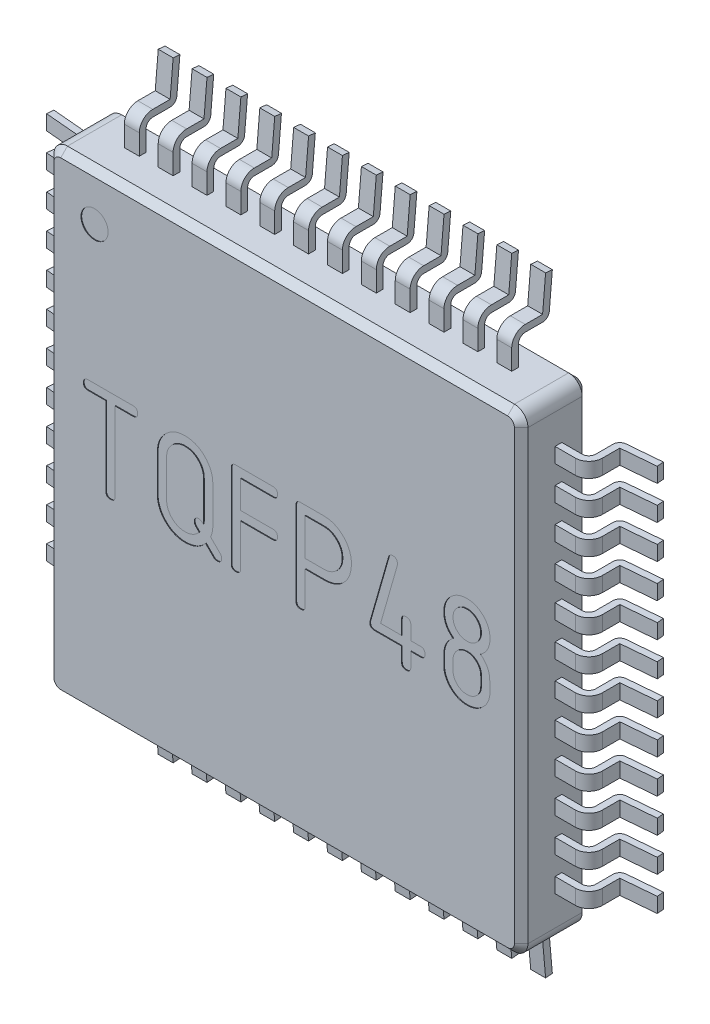
from build123d import *

# Parameters (mm, degrees)
EXTRUDE_1_DEPTH                  = 1
CHAMFER_1_SIZE                   = 0.1
EXTRUDE_2_DEPTH                  = 0.11
PATTERN_LINEAR_1_COUNT           = 12
PATTERN_LINEAR_1_PITCH           = 0.5
PATTERN_CIRCULAR_1_COUNT         = 4
PATTERN_CIRCULAR_1_COPY_1_DEPTH  = 0.11
PATTERN_CIRCULAR_1_COPY_2_DEPTH  = 0.11
PATTERN_CIRCULAR_1_COPY_3_DEPTH  = 0.11
PATTERN_CIRCULAR_1_COPY_4_DEPTH  = 0.11
PATTERN_CIRCULAR_1_COPY_5_DEPTH  = 0.11
PATTERN_CIRCULAR_1_COPY_6_DEPTH  = 0.11
PATTERN_CIRCULAR_1_COPY_7_DEPTH  = 0.11
PATTERN_CIRCULAR_1_COPY_8_DEPTH  = 0.11
PATTERN_CIRCULAR_1_COPY_9_DEPTH  = 0.11
PATTERN_CIRCULAR_1_COPY_10_DEPTH = 0.11
PATTERN_CIRCULAR_1_COPY_11_DEPTH = 0.11
PATTERN_CIRCULAR_1_COPY_12_DEPTH = 0.11
PATTERN_CIRCULAR_1_COPY_13_DEPTH = 0.11
PATTERN_CIRCULAR_1_COPY_14_DEPTH = 0.11
PATTERN_CIRCULAR_1_COPY_15_DEPTH = 0.11
PATTERN_CIRCULAR_1_COPY_16_DEPTH = 0.11
PATTERN_CIRCULAR_1_COPY_17_DEPTH = 0.11
PATTERN_CIRCULAR_1_COPY_18_DEPTH = 0.11
PATTERN_CIRCULAR_1_COPY_19_DEPTH = 0.11
PATTERN_CIRCULAR_1_COPY_20_DEPTH = 0.11
PATTERN_CIRCULAR_1_COPY_21_DEPTH = 0.11
PATTERN_CIRCULAR_1_COPY_22_DEPTH = 0.11
PATTERN_CIRCULAR_1_COPY_23_DEPTH = 0.11
PATTERN_CIRCULAR_1_COPY_24_DEPTH = 0.11
PATTERN_CIRCULAR_1_COPY_25_DEPTH = 0.11
PATTERN_CIRCULAR_1_COPY_26_DEPTH = 0.11
PATTERN_CIRCULAR_1_COPY_27_DEPTH = 0.11
PATTERN_CIRCULAR_1_COPY_28_DEPTH = 0.11
PATTERN_CIRCULAR_1_COPY_29_DEPTH = 0.11
PATTERN_CIRCULAR_1_COPY_30_DEPTH = 0.11
PATTERN_CIRCULAR_1_COPY_31_DEPTH = 0.11
PATTERN_CIRCULAR_1_COPY_32_DEPTH = 0.11
PATTERN_CIRCULAR_1_COPY_33_DEPTH = 0.11
SKETCH_4_R                       = 0.2
CUT_EXTRUDE_1_DEPTH              = 0.01


with BuildPart() as part:
    # Эскиз2 → Бобышка-Вытянуть1 (new body)
    with BuildSketch(Plane.XY.offset(0.1)):
        with BuildLine():
            Line((-3.3, 3.5), (3.3, 3.5))
            ThreePointArc((3.3, 3.5), (3.441421356, 3.441421356), (3.5, 3.3))
            Line((3.5, 3.3), (3.5, -3.3))
            ThreePointArc((3.5, -3.3), (3.441421356, -3.441421356), (3.3, -3.5))
            Line((3.3, -3.5), (-3.3, -3.5))
            ThreePointArc((-3.3, -3.5), (-3.441421356, -3.441421356), (-3.5, -3.3))
            Line((-3.5, -3.3), (-3.5, 3.3))
            ThreePointArc((-3.5, 3.3), (-3.441421356, 3.441421356), (-3.3, 3.5))
        make_face()
    extrude(amount=EXTRUDE_1_DEPTH)

    # Фаска1
    chamfer_1_edges = [part.edges().sort_by_distance(p)[0] for p in [
        (3.441421356, -3.441421356, 1.1),
        (0, -3.5, 0.1),
        (-3.441421356, -3.441421356, 0.1),
        (3.5, 0, 1.1),
        (3.441421356, 3.441421356, 1.1),
        (0, 3.5, 1.1),
        (-3.441421356, 3.441421356, 1.1),
        (-3.5, 0, 1.1),
        (-3.441421356, -3.441421356, 1.1),
        (0, -3.5, 1.1),
        (-3.5, 0, 0.1),
        (-3.441421356, 3.441421356, 0.1),
        (0, 3.5, 0.1),
        (3.441421356, 3.441421356, 0.1),
        (3.5, 0, 0.1),
        (3.441421356, -3.441421356, 0.1),
    ]]
    chamfer(chamfer_1_edges, length=CHAMFER_1_SIZE)

    # Эскиз3 → Бобышка-Вытянуть2 (add, symmetric)
    with BuildSketch(Plane(origin=(0, 2.75, 0), x_dir=(-1, 0, 0), z_dir=(0, 1, 0))):
        with BuildLine():
            Line((3.5, 0.5), (3.8, 0.5))
            ThreePointArc((3.8, 0.5), (3.870710678, 0.470710678), (3.9, 0.4))
            Line((3.9, 0.4), (3.9, 0.144126316))
            ThreePointArc((3.9, 0.144126316), (3.926272266, 0.076567295), (3.991284426, 0.044506846))
            Line((3.991284426, 0.044506846), (4.5, 0))
            Line((4.5, 0), (4.508715574, 0.09961947))
            Line((4.508715574, 0.09961947), (4, 0.144126316))
            Line((4, 0.144126316), (4, 0.4))
            ThreePointArc((4, 0.4), (3.941421356, 0.541421356), (3.8, 0.6))
            Line((3.8, 0.6), (3.5, 0.6))
            Line((3.5, 0.6), (3.5, 0.5))
        make_face()
    extrude_2 = extrude(amount=EXTRUDE_2_DEPTH, both=True)

    # Линейный массив1: Бобышка-Вытянуть2 ×12
    with Locations(*[(0, -i * PATTERN_LINEAR_1_PITCH, 0) for i in range(1, PATTERN_LINEAR_1_COUNT)]):
        add(extrude_2)

    # Круговой массив1: Бобышка-Вытянуть2 ×4 about axis
    pattern_circular_1_axis = Axis((0, 0, 0), (0, 0, 1))
    for i in range(1, PATTERN_CIRCULAR_1_COUNT):
        add(extrude_2.rotate(pattern_circular_1_axis, i * 360 / PATTERN_CIRCULAR_1_COUNT))

    # Круговой массив1 copy 1 sketch → Круговой массив1 copy 1 (add, symmetric)
    with BuildSketch(Plane(origin=(-2.25, 0, 0), x_dir=(0, -1, 0), z_dir=(-1, 0, 0))):
        with BuildLine():
            Line((3.5, 0.5), (3.8, 0.5))
            ThreePointArc((3.8, 0.5), (3.870710678, 0.470710678), (3.9, 0.4))
            Line((3.9, 0.4), (3.9, 0.144126316))
            ThreePointArc((3.9, 0.144126316), (3.926272266, 0.076567295), (3.991284426, 0.044506846))
            Line((3.991284426, 0.044506846), (4.5, 0))
            Line((4.5, 0), (4.508715574, 0.09961947))
            Line((4.508715574, 0.09961947), (4, 0.144126316))
            Line((4, 0.144126316), (4, 0.4))
            ThreePointArc((4, 0.4), (3.941421356, 0.541421356), (3.8, 0.6))
            Line((3.8, 0.6), (3.5, 0.6))
            Line((3.5, 0.6), (3.5, 0.5))
        make_face()
    extrude(amount=PATTERN_CIRCULAR_1_COPY_1_DEPTH, both=True)

    # Круговой массив1 copy 2 sketch → Круговой массив1 copy 2 (add, symmetric)
    with BuildSketch(Plane.XZ.offset(2.25)):
        with BuildLine():
            Line((3.5, 0.5), (3.8, 0.5))
            ThreePointArc((3.8, 0.5), (3.870710678, 0.470710678), (3.9, 0.4))
            Line((3.9, 0.4), (3.9, 0.144126316))
            ThreePointArc((3.9, 0.144126316), (3.926272266, 0.076567295), (3.991284426, 0.044506846))
            Line((3.991284426, 0.044506846), (4.5, 0))
            Line((4.5, 0), (4.508715574, 0.09961947))
            Line((4.508715574, 0.09961947), (4, 0.144126316))
            Line((4, 0.144126316), (4, 0.4))
            ThreePointArc((4, 0.4), (3.941421356, 0.541421356), (3.8, 0.6))
            Line((3.8, 0.6), (3.5, 0.6))
            Line((3.5, 0.6), (3.5, 0.5))
        make_face()
    extrude(amount=PATTERN_CIRCULAR_1_COPY_2_DEPTH, both=True)

    # Круговой массив1 copy 3 sketch → Круговой массив1 copy 3 (add, symmetric)
    with BuildSketch(Plane.YZ.offset(2.25)):
        with BuildLine():
            Line((3.5, 0.5), (3.8, 0.5))
            ThreePointArc((3.8, 0.5), (3.870710678, 0.470710678), (3.9, 0.4))
            Line((3.9, 0.4), (3.9, 0.144126316))
            ThreePointArc((3.9, 0.144126316), (3.926272266, 0.076567295), (3.991284426, 0.044506846))
            Line((3.991284426, 0.044506846), (4.5, 0))
            Line((4.5, 0), (4.508715574, 0.09961947))
            Line((4.508715574, 0.09961947), (4, 0.144126316))
            Line((4, 0.144126316), (4, 0.4))
            ThreePointArc((4, 0.4), (3.941421356, 0.541421356), (3.8, 0.6))
            Line((3.8, 0.6), (3.5, 0.6))
            Line((3.5, 0.6), (3.5, 0.5))
        make_face()
    extrude(amount=PATTERN_CIRCULAR_1_COPY_3_DEPTH, both=True)

    # Круговой массив1 copy 4 sketch → Круговой массив1 copy 4 (add, symmetric)
    with BuildSketch(Plane(origin=(-1.75, 0, 0), x_dir=(0, -1, 0), z_dir=(-1, 0, 0))):
        with BuildLine():
            Line((3.5, 0.5), (3.8, 0.5))
            ThreePointArc((3.8, 0.5), (3.870710678, 0.470710678), (3.9, 0.4))
            Line((3.9, 0.4), (3.9, 0.144126316))
            ThreePointArc((3.9, 0.144126316), (3.926272266, 0.076567295), (3.991284426, 0.044506846))
            Line((3.991284426, 0.044506846), (4.5, 0))
            Line((4.5, 0), (4.508715574, 0.09961947))
            Line((4.508715574, 0.09961947), (4, 0.144126316))
            Line((4, 0.144126316), (4, 0.4))
            ThreePointArc((4, 0.4), (3.941421356, 0.541421356), (3.8, 0.6))
            Line((3.8, 0.6), (3.5, 0.6))
            Line((3.5, 0.6), (3.5, 0.5))
        make_face()
    extrude(amount=PATTERN_CIRCULAR_1_COPY_4_DEPTH, both=True)

    # Круговой массив1 copy 5 sketch → Круговой массив1 copy 5 (add, symmetric)
    with BuildSketch(Plane.XZ.offset(1.75)):
        with BuildLine():
            Line((3.5, 0.5), (3.8, 0.5))
            ThreePointArc((3.8, 0.5), (3.870710678, 0.470710678), (3.9, 0.4))
            Line((3.9, 0.4), (3.9, 0.144126316))
            ThreePointArc((3.9, 0.144126316), (3.926272266, 0.076567295), (3.991284426, 0.044506846))
            Line((3.991284426, 0.044506846), (4.5, 0))
            Line((4.5, 0), (4.508715574, 0.09961947))
            Line((4.508715574, 0.09961947), (4, 0.144126316))
            Line((4, 0.144126316), (4, 0.4))
            ThreePointArc((4, 0.4), (3.941421356, 0.541421356), (3.8, 0.6))
            Line((3.8, 0.6), (3.5, 0.6))
            Line((3.5, 0.6), (3.5, 0.5))
        make_face()
    extrude(amount=PATTERN_CIRCULAR_1_COPY_5_DEPTH, both=True)

    # Круговой массив1 copy 6 sketch → Круговой массив1 copy 6 (add, symmetric)
    with BuildSketch(Plane.YZ.offset(1.75)):
        with BuildLine():
            Line((3.5, 0.5), (3.8, 0.5))
            ThreePointArc((3.8, 0.5), (3.870710678, 0.470710678), (3.9, 0.4))
            Line((3.9, 0.4), (3.9, 0.144126316))
            ThreePointArc((3.9, 0.144126316), (3.926272266, 0.076567295), (3.991284426, 0.044506846))
            Line((3.991284426, 0.044506846), (4.5, 0))
            Line((4.5, 0), (4.508715574, 0.09961947))
            Line((4.508715574, 0.09961947), (4, 0.144126316))
            Line((4, 0.144126316), (4, 0.4))
            ThreePointArc((4, 0.4), (3.941421356, 0.541421356), (3.8, 0.6))
            Line((3.8, 0.6), (3.5, 0.6))
            Line((3.5, 0.6), (3.5, 0.5))
        make_face()
    extrude(amount=PATTERN_CIRCULAR_1_COPY_6_DEPTH, both=True)

    # Круговой массив1 copy 7 sketch → Круговой массив1 copy 7 (add, symmetric)
    with BuildSketch(Plane(origin=(-1.25, 0, 0), x_dir=(0, -1, 0), z_dir=(-1, 0, 0))):
        with BuildLine():
            Line((3.5, 0.5), (3.8, 0.5))
            ThreePointArc((3.8, 0.5), (3.870710678, 0.470710678), (3.9, 0.4))
            Line((3.9, 0.4), (3.9, 0.144126316))
            ThreePointArc((3.9, 0.144126316), (3.926272266, 0.076567295), (3.991284426, 0.044506846))
            Line((3.991284426, 0.044506846), (4.5, 0))
            Line((4.5, 0), (4.508715574, 0.09961947))
            Line((4.508715574, 0.09961947), (4, 0.144126316))
            Line((4, 0.144126316), (4, 0.4))
            ThreePointArc((4, 0.4), (3.941421356, 0.541421356), (3.8, 0.6))
            Line((3.8, 0.6), (3.5, 0.6))
            Line((3.5, 0.6), (3.5, 0.5))
        make_face()
    extrude(amount=PATTERN_CIRCULAR_1_COPY_7_DEPTH, both=True)

    # Круговой массив1 copy 8 sketch → Круговой массив1 copy 8 (add, symmetric)
    with BuildSketch(Plane.XZ.offset(1.25)):
        with BuildLine():
            Line((3.5, 0.5), (3.8, 0.5))
            ThreePointArc((3.8, 0.5), (3.870710678, 0.470710678), (3.9, 0.4))
            Line((3.9, 0.4), (3.9, 0.144126316))
            ThreePointArc((3.9, 0.144126316), (3.926272266, 0.076567295), (3.991284426, 0.044506846))
            Line((3.991284426, 0.044506846), (4.5, 0))
            Line((4.5, 0), (4.508715574, 0.09961947))
            Line((4.508715574, 0.09961947), (4, 0.144126316))
            Line((4, 0.144126316), (4, 0.4))
            ThreePointArc((4, 0.4), (3.941421356, 0.541421356), (3.8, 0.6))
            Line((3.8, 0.6), (3.5, 0.6))
            Line((3.5, 0.6), (3.5, 0.5))
        make_face()
    extrude(amount=PATTERN_CIRCULAR_1_COPY_8_DEPTH, both=True)

    # Круговой массив1 copy 9 sketch → Круговой массив1 copy 9 (add, symmetric)
    with BuildSketch(Plane.YZ.offset(1.25)):
        with BuildLine():
            Line((3.5, 0.5), (3.8, 0.5))
            ThreePointArc((3.8, 0.5), (3.870710678, 0.470710678), (3.9, 0.4))
            Line((3.9, 0.4), (3.9, 0.144126316))
            ThreePointArc((3.9, 0.144126316), (3.926272266, 0.076567295), (3.991284426, 0.044506846))
            Line((3.991284426, 0.044506846), (4.5, 0))
            Line((4.5, 0), (4.508715574, 0.09961947))
            Line((4.508715574, 0.09961947), (4, 0.144126316))
            Line((4, 0.144126316), (4, 0.4))
            ThreePointArc((4, 0.4), (3.941421356, 0.541421356), (3.8, 0.6))
            Line((3.8, 0.6), (3.5, 0.6))
            Line((3.5, 0.6), (3.5, 0.5))
        make_face()
    extrude(amount=PATTERN_CIRCULAR_1_COPY_9_DEPTH, both=True)

    # Круговой массив1 copy 10 sketch → Круговой массив1 copy 10 (add, symmetric)
    with BuildSketch(Plane(origin=(-0.75, 0, 0), x_dir=(0, -1, 0), z_dir=(-1, 0, 0))):
        with BuildLine():
            Line((3.5, 0.5), (3.8, 0.5))
            ThreePointArc((3.8, 0.5), (3.870710678, 0.470710678), (3.9, 0.4))
            Line((3.9, 0.4), (3.9, 0.144126316))
            ThreePointArc((3.9, 0.144126316), (3.926272266, 0.076567295), (3.991284426, 0.044506846))
            Line((3.991284426, 0.044506846), (4.5, 0))
            Line((4.5, 0), (4.508715574, 0.09961947))
            Line((4.508715574, 0.09961947), (4, 0.144126316))
            Line((4, 0.144126316), (4, 0.4))
            ThreePointArc((4, 0.4), (3.941421356, 0.541421356), (3.8, 0.6))
            Line((3.8, 0.6), (3.5, 0.6))
            Line((3.5, 0.6), (3.5, 0.5))
        make_face()
    extrude(amount=PATTERN_CIRCULAR_1_COPY_10_DEPTH, both=True)

    # Круговой массив1 copy 11 sketch → Круговой массив1 copy 11 (add, symmetric)
    with BuildSketch(Plane.XZ.offset(0.75)):
        with BuildLine():
            Line((3.5, 0.5), (3.8, 0.5))
            ThreePointArc((3.8, 0.5), (3.870710678, 0.470710678), (3.9, 0.4))
            Line((3.9, 0.4), (3.9, 0.144126316))
            ThreePointArc((3.9, 0.144126316), (3.926272266, 0.076567295), (3.991284426, 0.044506846))
            Line((3.991284426, 0.044506846), (4.5, 0))
            Line((4.5, 0), (4.508715574, 0.09961947))
            Line((4.508715574, 0.09961947), (4, 0.144126316))
            Line((4, 0.144126316), (4, 0.4))
            ThreePointArc((4, 0.4), (3.941421356, 0.541421356), (3.8, 0.6))
            Line((3.8, 0.6), (3.5, 0.6))
            Line((3.5, 0.6), (3.5, 0.5))
        make_face()
    extrude(amount=PATTERN_CIRCULAR_1_COPY_11_DEPTH, both=True)

    # Круговой массив1 copy 12 sketch → Круговой массив1 copy 12 (add, symmetric)
    with BuildSketch(Plane.YZ.offset(0.75)):
        with BuildLine():
            Line((3.5, 0.5), (3.8, 0.5))
            ThreePointArc((3.8, 0.5), (3.870710678, 0.470710678), (3.9, 0.4))
            Line((3.9, 0.4), (3.9, 0.144126316))
            ThreePointArc((3.9, 0.144126316), (3.926272266, 0.076567295), (3.991284426, 0.044506846))
            Line((3.991284426, 0.044506846), (4.5, 0))
            Line((4.5, 0), (4.508715574, 0.09961947))
            Line((4.508715574, 0.09961947), (4, 0.144126316))
            Line((4, 0.144126316), (4, 0.4))
            ThreePointArc((4, 0.4), (3.941421356, 0.541421356), (3.8, 0.6))
            Line((3.8, 0.6), (3.5, 0.6))
            Line((3.5, 0.6), (3.5, 0.5))
        make_face()
    extrude(amount=PATTERN_CIRCULAR_1_COPY_12_DEPTH, both=True)

    # Круговой массив1 copy 13 sketch → Круговой массив1 copy 13 (add, symmetric)
    with BuildSketch(Plane(origin=(-0.25, 0, 0), x_dir=(0, -1, 0), z_dir=(-1, 0, 0))):
        with BuildLine():
            Line((3.5, 0.5), (3.8, 0.5))
            ThreePointArc((3.8, 0.5), (3.870710678, 0.470710678), (3.9, 0.4))
            Line((3.9, 0.4), (3.9, 0.144126316))
            ThreePointArc((3.9, 0.144126316), (3.926272266, 0.076567295), (3.991284426, 0.044506846))
            Line((3.991284426, 0.044506846), (4.5, 0))
            Line((4.5, 0), (4.508715574, 0.09961947))
            Line((4.508715574, 0.09961947), (4, 0.144126316))
            Line((4, 0.144126316), (4, 0.4))
            ThreePointArc((4, 0.4), (3.941421356, 0.541421356), (3.8, 0.6))
            Line((3.8, 0.6), (3.5, 0.6))
            Line((3.5, 0.6), (3.5, 0.5))
        make_face()
    extrude(amount=PATTERN_CIRCULAR_1_COPY_13_DEPTH, both=True)

    # Круговой массив1 copy 14 sketch → Круговой массив1 copy 14 (add, symmetric)
    with BuildSketch(Plane.XZ.offset(0.25)):
        with BuildLine():
            Line((3.5, 0.5), (3.8, 0.5))
            ThreePointArc((3.8, 0.5), (3.870710678, 0.470710678), (3.9, 0.4))
            Line((3.9, 0.4), (3.9, 0.144126316))
            ThreePointArc((3.9, 0.144126316), (3.926272266, 0.076567295), (3.991284426, 0.044506846))
            Line((3.991284426, 0.044506846), (4.5, 0))
            Line((4.5, 0), (4.508715574, 0.09961947))
            Line((4.508715574, 0.09961947), (4, 0.144126316))
            Line((4, 0.144126316), (4, 0.4))
            ThreePointArc((4, 0.4), (3.941421356, 0.541421356), (3.8, 0.6))
            Line((3.8, 0.6), (3.5, 0.6))
            Line((3.5, 0.6), (3.5, 0.5))
        make_face()
    extrude(amount=PATTERN_CIRCULAR_1_COPY_14_DEPTH, both=True)

    # Круговой массив1 copy 15 sketch → Круговой массив1 copy 15 (add, symmetric)
    with BuildSketch(Plane.YZ.offset(0.25)):
        with BuildLine():
            Line((3.5, 0.5), (3.8, 0.5))
            ThreePointArc((3.8, 0.5), (3.870710678, 0.470710678), (3.9, 0.4))
            Line((3.9, 0.4), (3.9, 0.144126316))
            ThreePointArc((3.9, 0.144126316), (3.926272266, 0.076567295), (3.991284426, 0.044506846))
            Line((3.991284426, 0.044506846), (4.5, 0))
            Line((4.5, 0), (4.508715574, 0.09961947))
            Line((4.508715574, 0.09961947), (4, 0.144126316))
            Line((4, 0.144126316), (4, 0.4))
            ThreePointArc((4, 0.4), (3.941421356, 0.541421356), (3.8, 0.6))
            Line((3.8, 0.6), (3.5, 0.6))
            Line((3.5, 0.6), (3.5, 0.5))
        make_face()
    extrude(amount=PATTERN_CIRCULAR_1_COPY_15_DEPTH, both=True)

    # Круговой массив1 copy 16 sketch → Круговой массив1 copy 16 (add, symmetric)
    with BuildSketch(Plane(origin=(0.25, 0, 0), x_dir=(0, -1, 0), z_dir=(-1, 0, 0))):
        with BuildLine():
            Line((3.5, 0.5), (3.8, 0.5))
            ThreePointArc((3.8, 0.5), (3.870710678, 0.470710678), (3.9, 0.4))
            Line((3.9, 0.4), (3.9, 0.144126316))
            ThreePointArc((3.9, 0.144126316), (3.926272266, 0.076567295), (3.991284426, 0.044506846))
            Line((3.991284426, 0.044506846), (4.5, 0))
            Line((4.5, 0), (4.508715574, 0.09961947))
            Line((4.508715574, 0.09961947), (4, 0.144126316))
            Line((4, 0.144126316), (4, 0.4))
            ThreePointArc((4, 0.4), (3.941421356, 0.541421356), (3.8, 0.6))
            Line((3.8, 0.6), (3.5, 0.6))
            Line((3.5, 0.6), (3.5, 0.5))
        make_face()
    extrude(amount=PATTERN_CIRCULAR_1_COPY_16_DEPTH, both=True)

    # Круговой массив1 copy 17 sketch → Круговой массив1 copy 17 (add, symmetric)
    with BuildSketch(Plane.XZ.offset(-0.25)):
        with BuildLine():
            Line((3.5, 0.5), (3.8, 0.5))
            ThreePointArc((3.8, 0.5), (3.870710678, 0.470710678), (3.9, 0.4))
            Line((3.9, 0.4), (3.9, 0.144126316))
            ThreePointArc((3.9, 0.144126316), (3.926272266, 0.076567295), (3.991284426, 0.044506846))
            Line((3.991284426, 0.044506846), (4.5, 0))
            Line((4.5, 0), (4.508715574, 0.09961947))
            Line((4.508715574, 0.09961947), (4, 0.144126316))
            Line((4, 0.144126316), (4, 0.4))
            ThreePointArc((4, 0.4), (3.941421356, 0.541421356), (3.8, 0.6))
            Line((3.8, 0.6), (3.5, 0.6))
            Line((3.5, 0.6), (3.5, 0.5))
        make_face()
    extrude(amount=PATTERN_CIRCULAR_1_COPY_17_DEPTH, both=True)

    # Круговой массив1 copy 18 sketch → Круговой массив1 copy 18 (add, symmetric)
    with BuildSketch(Plane.YZ.offset(-0.25)):
        with BuildLine():
            Line((3.5, 0.5), (3.8, 0.5))
            ThreePointArc((3.8, 0.5), (3.870710678, 0.470710678), (3.9, 0.4))
            Line((3.9, 0.4), (3.9, 0.144126316))
            ThreePointArc((3.9, 0.144126316), (3.926272266, 0.076567295), (3.991284426, 0.044506846))
            Line((3.991284426, 0.044506846), (4.5, 0))
            Line((4.5, 0), (4.508715574, 0.09961947))
            Line((4.508715574, 0.09961947), (4, 0.144126316))
            Line((4, 0.144126316), (4, 0.4))
            ThreePointArc((4, 0.4), (3.941421356, 0.541421356), (3.8, 0.6))
            Line((3.8, 0.6), (3.5, 0.6))
            Line((3.5, 0.6), (3.5, 0.5))
        make_face()
    extrude(amount=PATTERN_CIRCULAR_1_COPY_18_DEPTH, both=True)

    # Круговой массив1 copy 19 sketch → Круговой массив1 copy 19 (add, symmetric)
    with BuildSketch(Plane(origin=(0.75, 0, 0), x_dir=(0, -1, 0), z_dir=(-1, 0, 0))):
        with BuildLine():
            Line((3.5, 0.5), (3.8, 0.5))
            ThreePointArc((3.8, 0.5), (3.870710678, 0.470710678), (3.9, 0.4))
            Line((3.9, 0.4), (3.9, 0.144126316))
            ThreePointArc((3.9, 0.144126316), (3.926272266, 0.076567295), (3.991284426, 0.044506846))
            Line((3.991284426, 0.044506846), (4.5, 0))
            Line((4.5, 0), (4.508715574, 0.09961947))
            Line((4.508715574, 0.09961947), (4, 0.144126316))
            Line((4, 0.144126316), (4, 0.4))
            ThreePointArc((4, 0.4), (3.941421356, 0.541421356), (3.8, 0.6))
            Line((3.8, 0.6), (3.5, 0.6))
            Line((3.5, 0.6), (3.5, 0.5))
        make_face()
    extrude(amount=PATTERN_CIRCULAR_1_COPY_19_DEPTH, both=True)

    # Круговой массив1 copy 20 sketch → Круговой массив1 copy 20 (add, symmetric)
    with BuildSketch(Plane.XZ.offset(-0.75)):
        with BuildLine():
            Line((3.5, 0.5), (3.8, 0.5))
            ThreePointArc((3.8, 0.5), (3.870710678, 0.470710678), (3.9, 0.4))
            Line((3.9, 0.4), (3.9, 0.144126316))
            ThreePointArc((3.9, 0.144126316), (3.926272266, 0.076567295), (3.991284426, 0.044506846))
            Line((3.991284426, 0.044506846), (4.5, 0))
            Line((4.5, 0), (4.508715574, 0.09961947))
            Line((4.508715574, 0.09961947), (4, 0.144126316))
            Line((4, 0.144126316), (4, 0.4))
            ThreePointArc((4, 0.4), (3.941421356, 0.541421356), (3.8, 0.6))
            Line((3.8, 0.6), (3.5, 0.6))
            Line((3.5, 0.6), (3.5, 0.5))
        make_face()
    extrude(amount=PATTERN_CIRCULAR_1_COPY_20_DEPTH, both=True)

    # Круговой массив1 copy 21 sketch → Круговой массив1 copy 21 (add, symmetric)
    with BuildSketch(Plane.YZ.offset(-0.75)):
        with BuildLine():
            Line((3.5, 0.5), (3.8, 0.5))
            ThreePointArc((3.8, 0.5), (3.870710678, 0.470710678), (3.9, 0.4))
            Line((3.9, 0.4), (3.9, 0.144126316))
            ThreePointArc((3.9, 0.144126316), (3.926272266, 0.076567295), (3.991284426, 0.044506846))
            Line((3.991284426, 0.044506846), (4.5, 0))
            Line((4.5, 0), (4.508715574, 0.09961947))
            Line((4.508715574, 0.09961947), (4, 0.144126316))
            Line((4, 0.144126316), (4, 0.4))
            ThreePointArc((4, 0.4), (3.941421356, 0.541421356), (3.8, 0.6))
            Line((3.8, 0.6), (3.5, 0.6))
            Line((3.5, 0.6), (3.5, 0.5))
        make_face()
    extrude(amount=PATTERN_CIRCULAR_1_COPY_21_DEPTH, both=True)

    # Круговой массив1 copy 22 sketch → Круговой массив1 copy 22 (add, symmetric)
    with BuildSketch(Plane(origin=(1.25, 0, 0), x_dir=(0, -1, 0), z_dir=(-1, 0, 0))):
        with BuildLine():
            Line((3.5, 0.5), (3.8, 0.5))
            ThreePointArc((3.8, 0.5), (3.870710678, 0.470710678), (3.9, 0.4))
            Line((3.9, 0.4), (3.9, 0.144126316))
            ThreePointArc((3.9, 0.144126316), (3.926272266, 0.076567295), (3.991284426, 0.044506846))
            Line((3.991284426, 0.044506846), (4.5, 0))
            Line((4.5, 0), (4.508715574, 0.09961947))
            Line((4.508715574, 0.09961947), (4, 0.144126316))
            Line((4, 0.144126316), (4, 0.4))
            ThreePointArc((4, 0.4), (3.941421356, 0.541421356), (3.8, 0.6))
            Line((3.8, 0.6), (3.5, 0.6))
            Line((3.5, 0.6), (3.5, 0.5))
        make_face()
    extrude(amount=PATTERN_CIRCULAR_1_COPY_22_DEPTH, both=True)

    # Круговой массив1 copy 23 sketch → Круговой массив1 copy 23 (add, symmetric)
    with BuildSketch(Plane.XZ.offset(-1.25)):
        with BuildLine():
            Line((3.5, 0.5), (3.8, 0.5))
            ThreePointArc((3.8, 0.5), (3.870710678, 0.470710678), (3.9, 0.4))
            Line((3.9, 0.4), (3.9, 0.144126316))
            ThreePointArc((3.9, 0.144126316), (3.926272266, 0.076567295), (3.991284426, 0.044506846))
            Line((3.991284426, 0.044506846), (4.5, 0))
            Line((4.5, 0), (4.508715574, 0.09961947))
            Line((4.508715574, 0.09961947), (4, 0.144126316))
            Line((4, 0.144126316), (4, 0.4))
            ThreePointArc((4, 0.4), (3.941421356, 0.541421356), (3.8, 0.6))
            Line((3.8, 0.6), (3.5, 0.6))
            Line((3.5, 0.6), (3.5, 0.5))
        make_face()
    extrude(amount=PATTERN_CIRCULAR_1_COPY_23_DEPTH, both=True)

    # Круговой массив1 copy 24 sketch → Круговой массив1 copy 24 (add, symmetric)
    with BuildSketch(Plane.YZ.offset(-1.25)):
        with BuildLine():
            Line((3.5, 0.5), (3.8, 0.5))
            ThreePointArc((3.8, 0.5), (3.870710678, 0.470710678), (3.9, 0.4))
            Line((3.9, 0.4), (3.9, 0.144126316))
            ThreePointArc((3.9, 0.144126316), (3.926272266, 0.076567295), (3.991284426, 0.044506846))
            Line((3.991284426, 0.044506846), (4.5, 0))
            Line((4.5, 0), (4.508715574, 0.09961947))
            Line((4.508715574, 0.09961947), (4, 0.144126316))
            Line((4, 0.144126316), (4, 0.4))
            ThreePointArc((4, 0.4), (3.941421356, 0.541421356), (3.8, 0.6))
            Line((3.8, 0.6), (3.5, 0.6))
            Line((3.5, 0.6), (3.5, 0.5))
        make_face()
    extrude(amount=PATTERN_CIRCULAR_1_COPY_24_DEPTH, both=True)

    # Круговой массив1 copy 25 sketch → Круговой массив1 copy 25 (add, symmetric)
    with BuildSketch(Plane(origin=(1.75, 0, 0), x_dir=(0, -1, 0), z_dir=(-1, 0, 0))):
        with BuildLine():
            Line((3.5, 0.5), (3.8, 0.5))
            ThreePointArc((3.8, 0.5), (3.870710678, 0.470710678), (3.9, 0.4))
            Line((3.9, 0.4), (3.9, 0.144126316))
            ThreePointArc((3.9, 0.144126316), (3.926272266, 0.076567295), (3.991284426, 0.044506846))
            Line((3.991284426, 0.044506846), (4.5, 0))
            Line((4.5, 0), (4.508715574, 0.09961947))
            Line((4.508715574, 0.09961947), (4, 0.144126316))
            Line((4, 0.144126316), (4, 0.4))
            ThreePointArc((4, 0.4), (3.941421356, 0.541421356), (3.8, 0.6))
            Line((3.8, 0.6), (3.5, 0.6))
            Line((3.5, 0.6), (3.5, 0.5))
        make_face()
    extrude(amount=PATTERN_CIRCULAR_1_COPY_25_DEPTH, both=True)

    # Круговой массив1 copy 26 sketch → Круговой массив1 copy 26 (add, symmetric)
    with BuildSketch(Plane.XZ.offset(-1.75)):
        with BuildLine():
            Line((3.5, 0.5), (3.8, 0.5))
            ThreePointArc((3.8, 0.5), (3.870710678, 0.470710678), (3.9, 0.4))
            Line((3.9, 0.4), (3.9, 0.144126316))
            ThreePointArc((3.9, 0.144126316), (3.926272266, 0.076567295), (3.991284426, 0.044506846))
            Line((3.991284426, 0.044506846), (4.5, 0))
            Line((4.5, 0), (4.508715574, 0.09961947))
            Line((4.508715574, 0.09961947), (4, 0.144126316))
            Line((4, 0.144126316), (4, 0.4))
            ThreePointArc((4, 0.4), (3.941421356, 0.541421356), (3.8, 0.6))
            Line((3.8, 0.6), (3.5, 0.6))
            Line((3.5, 0.6), (3.5, 0.5))
        make_face()
    extrude(amount=PATTERN_CIRCULAR_1_COPY_26_DEPTH, both=True)

    # Круговой массив1 copy 27 sketch → Круговой массив1 copy 27 (add, symmetric)
    with BuildSketch(Plane.YZ.offset(-1.75)):
        with BuildLine():
            Line((3.5, 0.5), (3.8, 0.5))
            ThreePointArc((3.8, 0.5), (3.870710678, 0.470710678), (3.9, 0.4))
            Line((3.9, 0.4), (3.9, 0.144126316))
            ThreePointArc((3.9, 0.144126316), (3.926272266, 0.076567295), (3.991284426, 0.044506846))
            Line((3.991284426, 0.044506846), (4.5, 0))
            Line((4.5, 0), (4.508715574, 0.09961947))
            Line((4.508715574, 0.09961947), (4, 0.144126316))
            Line((4, 0.144126316), (4, 0.4))
            ThreePointArc((4, 0.4), (3.941421356, 0.541421356), (3.8, 0.6))
            Line((3.8, 0.6), (3.5, 0.6))
            Line((3.5, 0.6), (3.5, 0.5))
        make_face()
    extrude(amount=PATTERN_CIRCULAR_1_COPY_27_DEPTH, both=True)

    # Круговой массив1 copy 28 sketch → Круговой массив1 copy 28 (add, symmetric)
    with BuildSketch(Plane(origin=(2.25, 0, 0), x_dir=(0, -1, 0), z_dir=(-1, 0, 0))):
        with BuildLine():
            Line((3.5, 0.5), (3.8, 0.5))
            ThreePointArc((3.8, 0.5), (3.870710678, 0.470710678), (3.9, 0.4))
            Line((3.9, 0.4), (3.9, 0.144126316))
            ThreePointArc((3.9, 0.144126316), (3.926272266, 0.076567295), (3.991284426, 0.044506846))
            Line((3.991284426, 0.044506846), (4.5, 0))
            Line((4.5, 0), (4.508715574, 0.09961947))
            Line((4.508715574, 0.09961947), (4, 0.144126316))
            Line((4, 0.144126316), (4, 0.4))
            ThreePointArc((4, 0.4), (3.941421356, 0.541421356), (3.8, 0.6))
            Line((3.8, 0.6), (3.5, 0.6))
            Line((3.5, 0.6), (3.5, 0.5))
        make_face()
    extrude(amount=PATTERN_CIRCULAR_1_COPY_28_DEPTH, both=True)

    # Круговой массив1 copy 29 sketch → Круговой массив1 copy 29 (add, symmetric)
    with BuildSketch(Plane.XZ.offset(-2.25)):
        with BuildLine():
            Line((3.5, 0.5), (3.8, 0.5))
            ThreePointArc((3.8, 0.5), (3.870710678, 0.470710678), (3.9, 0.4))
            Line((3.9, 0.4), (3.9, 0.144126316))
            ThreePointArc((3.9, 0.144126316), (3.926272266, 0.076567295), (3.991284426, 0.044506846))
            Line((3.991284426, 0.044506846), (4.5, 0))
            Line((4.5, 0), (4.508715574, 0.09961947))
            Line((4.508715574, 0.09961947), (4, 0.144126316))
            Line((4, 0.144126316), (4, 0.4))
            ThreePointArc((4, 0.4), (3.941421356, 0.541421356), (3.8, 0.6))
            Line((3.8, 0.6), (3.5, 0.6))
            Line((3.5, 0.6), (3.5, 0.5))
        make_face()
    extrude(amount=PATTERN_CIRCULAR_1_COPY_29_DEPTH, both=True)

    # Круговой массив1 copy 30 sketch → Круговой массив1 copy 30 (add, symmetric)
    with BuildSketch(Plane.YZ.offset(-2.25)):
        with BuildLine():
            Line((3.5, 0.5), (3.8, 0.5))
            ThreePointArc((3.8, 0.5), (3.870710678, 0.470710678), (3.9, 0.4))
            Line((3.9, 0.4), (3.9, 0.144126316))
            ThreePointArc((3.9, 0.144126316), (3.926272266, 0.076567295), (3.991284426, 0.044506846))
            Line((3.991284426, 0.044506846), (4.5, 0))
            Line((4.5, 0), (4.508715574, 0.09961947))
            Line((4.508715574, 0.09961947), (4, 0.144126316))
            Line((4, 0.144126316), (4, 0.4))
            ThreePointArc((4, 0.4), (3.941421356, 0.541421356), (3.8, 0.6))
            Line((3.8, 0.6), (3.5, 0.6))
            Line((3.5, 0.6), (3.5, 0.5))
        make_face()
    extrude(amount=PATTERN_CIRCULAR_1_COPY_30_DEPTH, both=True)

    # Круговой массив1 copy 31 sketch → Круговой массив1 copy 31 (add, symmetric)
    with BuildSketch(Plane(origin=(2.75, 0, 0), x_dir=(0, -1, 0), z_dir=(-1, 0, 0))):
        with BuildLine():
            Line((3.5, 0.5), (3.8, 0.5))
            ThreePointArc((3.8, 0.5), (3.870710678, 0.470710678), (3.9, 0.4))
            Line((3.9, 0.4), (3.9, 0.144126316))
            ThreePointArc((3.9, 0.144126316), (3.926272266, 0.076567295), (3.991284426, 0.044506846))
            Line((3.991284426, 0.044506846), (4.5, 0))
            Line((4.5, 0), (4.508715574, 0.09961947))
            Line((4.508715574, 0.09961947), (4, 0.144126316))
            Line((4, 0.144126316), (4, 0.4))
            ThreePointArc((4, 0.4), (3.941421356, 0.541421356), (3.8, 0.6))
            Line((3.8, 0.6), (3.5, 0.6))
            Line((3.5, 0.6), (3.5, 0.5))
        make_face()
    extrude(amount=PATTERN_CIRCULAR_1_COPY_31_DEPTH, both=True)

    # Круговой массив1 copy 32 sketch → Круговой массив1 copy 32 (add, symmetric)
    with BuildSketch(Plane.XZ.offset(-2.75)):
        with BuildLine():
            Line((3.5, 0.5), (3.8, 0.5))
            ThreePointArc((3.8, 0.5), (3.870710678, 0.470710678), (3.9, 0.4))
            Line((3.9, 0.4), (3.9, 0.144126316))
            ThreePointArc((3.9, 0.144126316), (3.926272266, 0.076567295), (3.991284426, 0.044506846))
            Line((3.991284426, 0.044506846), (4.5, 0))
            Line((4.5, 0), (4.508715574, 0.09961947))
            Line((4.508715574, 0.09961947), (4, 0.144126316))
            Line((4, 0.144126316), (4, 0.4))
            ThreePointArc((4, 0.4), (3.941421356, 0.541421356), (3.8, 0.6))
            Line((3.8, 0.6), (3.5, 0.6))
            Line((3.5, 0.6), (3.5, 0.5))
        make_face()
    extrude(amount=PATTERN_CIRCULAR_1_COPY_32_DEPTH, both=True)

    # Круговой массив1 copy 33 sketch → Круговой массив1 copy 33 (add, symmetric)
    with BuildSketch(Plane.YZ.offset(-2.75)):
        with BuildLine():
            Line((3.5, 0.5), (3.8, 0.5))
            ThreePointArc((3.8, 0.5), (3.870710678, 0.470710678), (3.9, 0.4))
            Line((3.9, 0.4), (3.9, 0.144126316))
            ThreePointArc((3.9, 0.144126316), (3.926272266, 0.076567295), (3.991284426, 0.044506846))
            Line((3.991284426, 0.044506846), (4.5, 0))
            Line((4.5, 0), (4.508715574, 0.09961947))
            Line((4.508715574, 0.09961947), (4, 0.144126316))
            Line((4, 0.144126316), (4, 0.4))
            ThreePointArc((4, 0.4), (3.941421356, 0.541421356), (3.8, 0.6))
            Line((3.8, 0.6), (3.5, 0.6))
            Line((3.5, 0.6), (3.5, 0.5))
        make_face()
    extrude(amount=PATTERN_CIRCULAR_1_COPY_33_DEPTH, both=True)

    # Эскиз4 → Вырез-Вытянуть1 (cut)
    # profile 1 of 7: a face of its own
    with BuildSketch(Plane.XY.offset(1.1)):
        with Locations((-2.8, 2.8)):
            Circle(SKETCH_4_R)
    # profile 2 of 7: a face of its own
    with BuildSketch(Plane.XY.offset(1.1)):
        with BuildLine():
            add(Edge.make_bspline(
                [(-2.963574219, 0.696044922), (-2.963499556, 0.701454201), (-2.963359739, 0.711583935), (-2.959706908, 0.725607276), (-2.954827007, 0.737767671), (-2.947088481, 0.747551936), (-2.937604046, 0.755357852), (-2.925690402, 0.760522822), (-2.912002269, 0.763970293), (-2.902085023, 0.764158899), (-2.896883937, 0.764257812)],
                knots=[0, 0, 0, 0, 1.182571124, 2.214551965, 3.162306919, 4.035667748, 4.922840852, 5.829928053, 6.861908894, 8, 8, 8, 8], degree=3))
            Line((-2.896883937, 0.764257812), (-2.23119921, 0.764257812))
            add(Edge.make_bspline(
                [(-2.23119921, 0.764257812), (-2.225998125, 0.764158899), (-2.216080879, 0.763970293), (-2.202392745, 0.760522822), (-2.190479101, 0.755357852), (-2.180994666, 0.747551936), (-2.17325614, 0.737767671), (-2.168376239, 0.725607276), (-2.164723409, 0.711583935), (-2.164583591, 0.701454201), (-2.164508929, 0.696044922)],
                knots=[0, 0, 0, 0, 1.138091106, 2.170071947, 3.077159148, 3.964332252, 4.837693081, 5.785448035, 6.817428876, 8, 8, 8, 8], degree=3))
            add(Edge.make_bspline(
                [(-2.164508929, 0.696044922), (-2.16461301, 0.690746895), (-2.164811602, 0.680638014), (-2.168199576, 0.66659925), (-2.173509728, 0.654673554), (-2.180438751, 0.644415267), (-2.190461836, 0.637097944), (-2.202079332, 0.631480892), (-2.215944173, 0.628591162), (-2.225707207, 0.628095432), (-2.230894688, 0.627832031)],
                knots=[0, 0, 0, 0, 1.164100439, 2.221157785, 3.151547364, 4.032294591, 4.90849306, 5.848230839, 6.856681008, 8, 8, 8, 8], degree=3))
            Line((-2.230894688, 0.627832031), (-2.495828683, 0.627832031))
            Line((-2.495828683, 0.627832031), (-2.495828683, -0.531787109))
            add(Edge.make_bspline(
                [(-2.495828683, -0.531787109), (-2.495928294, -0.537088561), (-2.496118356, -0.547203977), (-2.499563506, -0.561198939), (-2.504736518, -0.573379218), (-2.512419091, -0.583224228), (-2.522407957, -0.590852025), (-2.534345958, -0.596326841), (-2.548578254, -0.599267683), (-2.558648587, -0.599744597), (-2.564041574, -0.6)],
                knots=[0, 0, 0, 0, 1.147825403, 2.190104258, 3.107486261, 4.002358969, 4.866307497, 5.812869616, 6.828721528, 8, 8, 8, 8], degree=3))
            add(Edge.make_bspline(
                [(-2.564041574, -0.6), (-2.569325484, -0.599719929), (-2.579378707, -0.599187063), (-2.593606427, -0.596480885), (-2.605426383, -0.59064299), (-2.615707934, -0.58345347), (-2.622897454, -0.573171919), (-2.628735349, -0.561351963), (-2.631441527, -0.547124243), (-2.631974393, -0.537071019), (-2.632254464, -0.531787109)],
                knots=[0, 0, 0, 0, 1.150813752, 2.189550435, 3.117366144, 4, 4.882633856, 5.810449565, 6.849186248, 8, 8, 8, 8], degree=3))
            Line((-2.632254464, -0.531787109), (-2.632254464, 0.627832031))
            Line((-2.632254464, 0.627832031), (-2.897188459, 0.627832031))
            add(Edge.make_bspline(
                [(-2.897188459, 0.627832031), (-2.902378118, 0.628092994), (-2.91214525, 0.628584134), (-2.925982734, 0.631504498), (-2.937619773, 0.636983845), (-2.947322918, 0.644622303), (-2.954632263, 0.654550842), (-2.959857597, 0.666620355), (-2.963279189, 0.680631803), (-2.963472766, 0.69074476), (-2.963574219, 0.696044922)],
                knots=[0, 0, 0, 0, 1.14393887, 2.152935795, 3.093183076, 3.952283899, 4.846743947, 5.77763796, 6.835268415, 8, 8, 8, 8], degree=3))
        make_face()
    # profile 3 of 7: a face of its own
    with BuildSketch(Plane.XY.offset(1.1)):
        with BuildLine():
            add(Edge.make_bspline(
                [(-1.160195923, -0.461138044), (-1.170197696, -0.472253357), (-1.189843272, -0.49408616), (-1.223271134, -0.522099026), (-1.258231905, -0.546481853), (-1.295758043, -0.565990186), (-1.335136658, -0.581394886), (-1.376793706, -0.591886148), (-1.420322842, -0.598925758), (-1.450173713, -0.599638296), (-1.4653268, -0.6)],
                knots=[0, 0, 0, 0, 1.034406248, 2.031790478, 3.012635843, 3.981159625, 4.953782538, 5.93422472, 6.951358134, 8, 8, 8, 8], degree=3))
            add(Edge.make_bspline(
                [(-1.4653268, -0.6), (-1.479156527, -0.599702973), (-1.506333311, -0.599119286), (-1.546242958, -0.592888213), (-1.584787025, -0.58400025), (-1.62181612, -0.570898562), (-1.656950393, -0.553444963), (-1.691030394, -0.533252296), (-1.723043289, -0.508433173), (-1.753560646, -0.480794077), (-1.781358345, -0.450345094), (-1.805548371, -0.417854067), (-1.826187954, -0.383854704), (-1.842860438, -0.34817081), (-1.856147532, -0.310981637), (-1.865543444, -0.272313709), (-1.871159889, -0.231998845), (-1.871827891, -0.204647254), (-1.872167969, -0.190722656)],
                knots=[0, 0, 0, 0, 1.033312615, 2.030561505, 3.013700211, 3.988422536, 4.959324787, 5.943459254, 6.945434469, 7.982448381, 9.019462293, 10.022931451, 11.007065918, 11.988386222, 12.963108547, 13.955405407, 14.959104204, 16, 16, 16, 16], degree=3))
            Line((-1.872167969, -0.190722656), (-1.872167969, 0.354980469))
            add(Edge.make_bspline(
                [(-1.872167969, 0.354980469), (-1.871871855, 0.368911895), (-1.871289907, 0.396291105), (-1.865044547, 0.436498851), (-1.856233107, 0.4752723), (-1.842980742, 0.512443171), (-1.825717057, 0.547774677), (-1.805313206, 0.581925923), (-1.780709523, 0.614197849), (-1.752958854, 0.644741217), (-1.722426554, 0.672520544), (-1.690041995, 0.697034679), (-1.656026417, 0.717951867), (-1.620404938, 0.734972783), (-1.5831919, 0.748341133), (-1.544406435, 0.757129436), (-1.504201935, 0.763381049), (-1.476822278, 0.763962136), (-1.462890625, 0.764257812)],
                knots=[0, 0, 0, 0, 1.037886018, 2.039740928, 3.027401155, 3.999305046, 4.97421019, 5.955499007, 6.96060772, 7.994623079, 9.028638438, 10.033747151, 11.018968421, 12.000694954, 12.972598845, 13.960259072, 14.962113982, 16, 16, 16, 16], degree=3))
            add(Edge.make_bspline(
                [(-1.462890625, 0.764257812), (-1.448961871, 0.76394563), (-1.421386839, 0.763327596), (-1.381042477, 0.757258971), (-1.342129955, 0.748197229), (-1.304881207, 0.735169331), (-1.269453951, 0.717692806), (-1.235099253, 0.697602947), (-1.203054632, 0.672676166), (-1.172501803, 0.645070659), (-1.144766058, 0.614498704), (-1.12018284, 0.582221352), (-1.099708241, 0.548155598), (-1.082765914, 0.512596211), (-1.069711542, 0.475311836), (-1.060188726, 0.436480643), (-1.05463108, 0.39594825), (-1.053956615, 0.368396503), (-1.053613281, 0.354371425)],
                knots=[0, 0, 0, 0, 1.036325472, 2.051634171, 3.03045615, 4.008022873, 4.981462168, 5.967753184, 6.965328966, 7.997789598, 9.030250231, 10.033847681, 11.013661049, 11.98383874, 12.961405463, 13.949345385, 14.956124537, 16, 16, 16, 16], degree=3))
            Line((-1.053613281, 0.354371425), (-1.053613281, -0.191940744))
            add(Edge.make_bspline(
                [(-1.053613281, -0.191940744), (-1.054044754, -0.20445193), (-1.05491266, -0.229618139), (-1.061354962, -0.267243131), (-1.071249545, -0.305089364), (-1.081147851, -0.329578004), (-1.086197117, -0.342070007)],
                knots=[0, 0, 0, 0, 0.970505138, 1.952167884, 2.955371787, 4, 4, 4, 4], degree=3))
            Line((-1.086197117, -0.342070007), (-0.945203509, -0.482759094))
            add(Edge.make_bspline(
                [(-0.945203509, -0.482759094), (-0.941843103, -0.486521727), (-0.93532734, -0.493817401), (-0.927628149, -0.506080737), (-0.923745773, -0.519483516), (-0.923026135, -0.528519545), (-0.922668893, -0.533005197)],
                knots=[0, 0, 0, 0, 1.071060325, 2.076765767, 3.045270919, 4, 4, 4, 4], degree=3))
            add(Edge.make_bspline(
                [(-0.922668893, -0.533005197), (-0.922745184, -0.538311598), (-0.922887906, -0.548238535), (-0.926511544, -0.561986621), (-0.931526274, -0.573844622), (-0.939069868, -0.583726459), (-0.949087887, -0.591054614), (-0.961063776, -0.596229641), (-0.974951532, -0.599739695), (-0.984970156, -0.59990991), (-0.99027274, -0.6)],
                knots=[0, 0, 0, 0, 1.162919306, 2.175528415, 3.104973992, 3.980283443, 4.873351745, 5.802797322, 6.837080694, 8, 8, 8, 8], degree=3))
            add(Edge.make_bspline(
                [(-0.99027274, -0.6), (-0.99528197, -0.599821462), (-1.004965954, -0.599476306), (-1.01866794, -0.595204019), (-1.031289792, -0.588857191), (-1.038212329, -0.582519396), (-1.04173693, -0.579292515)],
                knots=[0, 0, 0, 0, 1.051152796, 2.032117937, 2.998055438, 4, 4, 4, 4], degree=3))
            Line((-1.04173693, -0.579292515), (-1.160195923, -0.461138044))
        make_face()
        with BuildLine():
            add(Edge.make_bspline(
                [(-1.254597691, -0.365213667), (-1.262288201, -0.357677112), (-1.277773766, -0.342501552), (-1.293551785, -0.327630273), (-1.301494053, -0.320144435)],
                knots=[0, 0, 0, 0, 0.993248859, 2, 2, 2, 2], degree=3))
            add(Edge.make_bspline(
                [(-1.301494053, -0.320144435), (-1.305354689, -0.315507826), (-1.312744509, -0.306632677), (-1.320109667, -0.291747292), (-1.325641164, -0.277288661), (-1.326194823, -0.267408426), (-1.326464844, -0.262589809)],
                knots=[0, 0, 0, 0, 1.126404379, 2.156102701, 3.100726277, 4, 4, 4, 4], degree=3))
            add(Edge.make_bspline(
                [(-1.326464844, -0.262589809), (-1.326197842, -0.257301285), (-1.325694841, -0.247338322), (-1.322862869, -0.233265863), (-1.317168596, -0.221374597), (-1.309587077, -0.211474332), (-1.299649215, -0.203750606), (-1.28742795, -0.198794327), (-1.273271431, -0.195237406), (-1.26304889, -0.195072938), (-1.257642909, -0.194985962)],
                knots=[0, 0, 0, 0, 1.14927305, 2.165096508, 3.091670063, 3.986517706, 4.850442035, 5.787956674, 6.830206335, 8, 8, 8, 8], degree=3))
            add(Edge.make_bspline(
                [(-1.257642909, -0.194985962), (-1.252606041, -0.195431414), (-1.241823553, -0.196385), (-1.225781325, -0.203823791), (-1.209151941, -0.21538455), (-1.198725197, -0.225465629), (-1.193084281, -0.230919538)],
                knots=[0, 0, 0, 0, 0.796498202, 1.705073476, 2.758434321, 4, 4, 4, 4], degree=3))
            add(Edge.make_bspline(
                [(-1.193084281, -0.230919538), (-1.192120599, -0.224638209), (-1.190169846, -0.211923101), (-1.190083004, -0.199058971), (-1.190039063, -0.192549787)],
                knots=[0, 0, 0, 0, 0.988010265, 2, 2, 2, 2], degree=3))
            Line((-1.190039063, -0.192549787), (-1.190039063, 0.354371425))
            add(Edge.make_bspline(
                [(-1.190039063, 0.354371425), (-1.190274995, 0.363820846), (-1.190738546, 0.382386662), (-1.194336895, 0.409682193), (-1.20101143, 0.435661237), (-1.209180161, 0.460786363), (-1.22097766, 0.48433988), (-1.234008315, 0.507362552), (-1.250569616, 0.528692408), (-1.268881557, 0.548988072), (-1.289171939, 0.567313994), (-1.310466488, 0.583762523), (-1.33327572, 0.596982272), (-1.356788146, 0.608677485), (-1.381903172, 0.61686329), (-1.407884975, 0.62353334), (-1.435078915, 0.627118934), (-1.453542854, 0.627592353), (-1.462890625, 0.627832031)],
                knots=[0, 0, 0, 0, 1.053369312, 2.069614645, 3.060402755, 4.040927392, 5.007642059, 5.991621439, 6.985184418, 8.010524553, 9.035864687, 10.029427666, 11.003663465, 11.970378132, 12.950902769, 13.941690878, 14.957936211, 16, 16, 16, 16], degree=3))
            add(Edge.make_bspline(
                [(-1.462890625, 0.627832031), (-1.472238543, 0.627592662), (-1.490702772, 0.627119853), (-1.517894594, 0.623529808), (-1.543884182, 0.616876117), (-1.569057887, 0.608601725), (-1.592750931, 0.597069935), (-1.615611686, 0.583749737), (-1.636923942, 0.567322995), (-1.657170563, 0.548964633), (-1.675597379, 0.528820737), (-1.691547741, 0.507192776), (-1.705376217, 0.484796435), (-1.71637279, 0.460910849), (-1.725298407, 0.436099025), (-1.731303407, 0.409922621), (-1.735066385, 0.382802552), (-1.735515044, 0.364331726), (-1.735742188, 0.354980469)],
                knots=[0, 0, 0, 0, 1.043079502, 2.060315384, 3.052069228, 4.033549595, 5.011428428, 5.986613828, 6.981145247, 8.007484794, 9.033824341, 10.021559559, 11.002582284, 11.965387447, 12.950586422, 13.939684616, 14.956920498, 16, 16, 16, 16], degree=3))
            Line((-1.735742188, 0.354980469), (-1.735742188, -0.190722656))
            add(Edge.make_bspline(
                [(-1.735742188, -0.190722656), (-1.73551295, -0.200073218), (-1.735060154, -0.218542668), (-1.731327332, -0.245672764), (-1.725219126, -0.271779832), (-1.716686284, -0.296784018), (-1.705739887, -0.320771743), (-1.691859011, -0.343245033), (-1.67590378, -0.364782694), (-1.657772934, -0.38497577), (-1.637930749, -0.403520261), (-1.616309282, -0.419365729), (-1.593930302, -0.433218763), (-1.570115239, -0.444136842), (-1.545540753, -0.453138711), (-1.519661527, -0.459133227), (-1.492745212, -0.462913752), (-1.474374034, -0.463351424), (-1.465022278, -0.463574219)],
                knots=[0, 0, 0, 0, 1.046826641, 2.067716821, 3.060368233, 4.045374452, 5.021948145, 6.006495077, 6.997778617, 8.020186662, 9.041836056, 10.033119595, 11.017666528, 11.983930454, 12.961958662, 13.943547904, 14.953173359, 16, 16, 16, 16], degree=3))
            add(Edge.make_bspline(
                [(-1.465022278, -0.463574219), (-1.454547751, -0.463300219), (-1.434002961, -0.462762794), (-1.40390771, -0.457975428), (-1.375167646, -0.450627345), (-1.348189899, -0.439274349), (-1.322269785, -0.425632203), (-1.298077045, -0.408488006), (-1.275077713, -0.388492209), (-1.261532446, -0.373096031), (-1.254597691, -0.365213667)],
                knots=[0, 0, 0, 0, 1.045093948, 2.049852409, 3.035622248, 3.999209887, 4.96498018, 5.954649543, 6.952844237, 8, 8, 8, 8], degree=3))
        make_face(mode=Mode.SUBTRACT)
    # profile 4 of 7: a face of its own
    with BuildSketch(Plane.XY.offset(1.1)):
        with BuildLine():
            Line((-0.780761719, -0.531787109), (-0.780761719, 0.696044922))
            add(Edge.make_bspline(
                [(-0.780761719, 0.696044922), (-0.780506316, 0.701437908), (-0.780029402, 0.711508242), (-0.77708856, 0.725740538), (-0.771613743, 0.737678539), (-0.763985947, 0.747667404), (-0.754140937, 0.755349977), (-0.741960657, 0.76052299), (-0.727965695, 0.763968139), (-0.71785028, 0.764158202), (-0.712548828, 0.764257812)],
                knots=[0, 0, 0, 0, 1.171278472, 2.187130384, 3.133692503, 3.997641031, 4.892513739, 5.809895742, 6.852174597, 8, 8, 8, 8], degree=3))
            Line((-0.712548828, 0.764257812), (-0.166845703, 0.764257812))
            add(Edge.make_bspline(
                [(-0.166845703, 0.764257812), (-0.161434516, 0.764185403), (-0.15130121, 0.764049806), (-0.137301425, 0.760369148), (-0.125003837, 0.755558147), (-0.115452933, 0.747437692), (-0.107332478, 0.737886788), (-0.102521477, 0.7255892), (-0.098840819, 0.711589415), (-0.098705222, 0.701456109), (-0.098632813, 0.696044922)],
                knots=[0, 0, 0, 0, 1.168121455, 2.187492668, 3.123667138, 4, 4.876332862, 5.812507332, 6.831878545, 8, 8, 8, 8], degree=3))
            add(Edge.make_bspline(
                [(-0.098632813, 0.696044922), (-0.098732423, 0.69074347), (-0.098922486, 0.680628055), (-0.102367635, 0.666633093), (-0.107540648, 0.654452813), (-0.115223221, 0.644607803), (-0.125212086, 0.636980007), (-0.137150087, 0.63150519), (-0.151382383, 0.628564348), (-0.161452717, 0.628087434), (-0.166845703, 0.627832031)],
                knots=[0, 0, 0, 0, 1.147825403, 2.190104258, 3.107486261, 4.002358969, 4.866307497, 5.812869616, 6.828721528, 8, 8, 8, 8], degree=3))
            Line((-0.166845703, 0.627832031), (-0.644335938, 0.627832031))
            Line((-0.644335938, 0.627832031), (-0.644335938, 0.218554687))
            Line((-0.644335938, 0.218554687), (-0.166845703, 0.218554687))
            add(Edge.make_bspline(
                [(-0.166845703, 0.218554687), (-0.161434516, 0.218482278), (-0.15130121, 0.218346681), (-0.137301425, 0.214666023), (-0.125003837, 0.209855022), (-0.115452933, 0.201734567), (-0.107332478, 0.192183663), (-0.102521477, 0.179886075), (-0.098840819, 0.16588629), (-0.098705222, 0.155752984), (-0.098632813, 0.150341797)],
                knots=[0, 0, 0, 0, 1.168121455, 2.187492668, 3.123667138, 4, 4.876332862, 5.812507332, 6.831878545, 8, 8, 8, 8], degree=3))
            add(Edge.make_bspline(
                [(-0.098632813, 0.150341797), (-0.098732423, 0.145040345), (-0.098922486, 0.13492493), (-0.102367635, 0.120929968), (-0.107540648, 0.108749688), (-0.115223221, 0.098904678), (-0.125212086, 0.091276882), (-0.137150087, 0.085802065), (-0.151382383, 0.082861223), (-0.161452717, 0.082384309), (-0.166845703, 0.082128906)],
                knots=[0, 0, 0, 0, 1.147825403, 2.190104258, 3.107486261, 4.002358969, 4.866307497, 5.812869616, 6.828721528, 8, 8, 8, 8], degree=3))
            Line((-0.166845703, 0.082128906), (-0.644335938, 0.082128906))
            Line((-0.644335938, 0.082128906), (-0.644335938, -0.531787109))
            add(Edge.make_bspline(
                [(-0.644335938, -0.531787109), (-0.644435548, -0.537088561), (-0.644625611, -0.547203977), (-0.64807076, -0.561198939), (-0.653243773, -0.573379218), (-0.660926346, -0.583224228), (-0.670915211, -0.590852025), (-0.682853212, -0.596326841), (-0.697085508, -0.599267683), (-0.707155842, -0.599744597), (-0.712548828, -0.6)],
                knots=[0, 0, 0, 0, 1.147825403, 2.190104258, 3.107486261, 4.002358969, 4.866307497, 5.812869616, 6.828721528, 8, 8, 8, 8], degree=3))
            add(Edge.make_bspline(
                [(-0.712548828, -0.6), (-0.717832738, -0.599719929), (-0.727885961, -0.599187063), (-0.742113682, -0.596480885), (-0.753933638, -0.59064299), (-0.764215189, -0.58345347), (-0.771404708, -0.573171919), (-0.777242604, -0.561351963), (-0.779948782, -0.547124243), (-0.780481648, -0.537071019), (-0.780761719, -0.531787109)],
                knots=[0, 0, 0, 0, 1.150813752, 2.189550435, 3.117366144, 4, 4.882633856, 5.810449565, 6.849186248, 8, 8, 8, 8], degree=3))
        make_face()
    # profile 5 of 7: a face of its own
    with BuildSketch(Plane.XY.offset(1.1)):
        with BuildLine():
            Line((0.242431641, 0.764257812), (0.583496094, 0.764257812))
            add(Edge.make_bspline(
                [(0.583496094, 0.764257812), (0.597417983, 0.763901895), (0.624965438, 0.763197637), (0.665418916, 0.75776159), (0.704216437, 0.74809686), (0.741428958, 0.735129366), (0.777012764, 0.718058443), (0.811277116, 0.697885569), (0.843330609, 0.672983646), (0.87390232, 0.645386695), (0.901499271, 0.614814984), (0.926401194, 0.582761491), (0.946574068, 0.548497139), (0.963644991, 0.512913333), (0.976612485, 0.475700812), (0.986277215, 0.436903291), (0.991713262, 0.396449813), (0.99241752, 0.368902358), (0.992773437, 0.354980469)],
                knots=[0, 0, 0, 0, 1.036939237, 2.051807482, 3.032988178, 4.011133866, 4.981886146, 5.968761294, 6.966927891, 8, 9.033072109, 10.031238706, 11.018113854, 11.988866134, 12.967011822, 13.948192518, 14.963060763, 16, 16, 16, 16], degree=3))
            add(Edge.make_bspline(
                [(0.992773437, 0.354980469), (0.992395026, 0.340149405), (0.991653969, 0.311105143), (0.986665207, 0.268606596), (0.977147726, 0.228494739), (0.965324028, 0.190111777), (0.948896963, 0.154136047), (0.929411304, 0.120038757), (0.906069229, 0.08822616), (0.879426872, 0.058831942), (0.849881731, 0.032512316), (0.818413142, 0.008967326), (0.784337337, -0.010435908), (0.748301392, -0.026738411), (0.710089179, -0.03916653), (0.669813943, -0.048052946), (0.627380463, -0.053214384), (0.598330214, -0.053930963), (0.583496094, -0.054296875)],
                knots=[0, 0, 0, 0, 1.094182227, 2.142780583, 3.149112558, 4.131878259, 5.100506844, 6.059945638, 7.024484533, 8.005194118, 8.980888131, 9.939391401, 10.898830195, 11.86745878, 12.852532483, 13.857219417, 14.905817773, 16, 16, 16, 16], degree=3))
            Line((0.583496094, -0.054296875), (0.310644531, -0.054296875))
            Line((0.310644531, -0.054296875), (0.310644531, -0.531787109))
            add(Edge.make_bspline(
                [(0.310644531, -0.531787109), (0.31054492, -0.537088561), (0.310354858, -0.547203977), (0.306909708, -0.561198939), (0.301736696, -0.573379218), (0.294054123, -0.583224228), (0.284065258, -0.590852025), (0.272127256, -0.596326841), (0.25789496, -0.599267683), (0.247824627, -0.599744597), (0.242431641, -0.6)],
                knots=[0, 0, 0, 0, 1.147825403, 2.190104258, 3.107486261, 4.002358969, 4.866307497, 5.812869616, 6.828721528, 8, 8, 8, 8], degree=3))
            add(Edge.make_bspline(
                [(0.242431641, -0.6), (0.237147731, -0.599719929), (0.227094507, -0.599187063), (0.212866787, -0.596480885), (0.201046831, -0.59064299), (0.19076528, -0.58345347), (0.18357576, -0.573171919), (0.177737865, -0.561351963), (0.175031687, -0.547124243), (0.174498821, -0.537071019), (0.17421875, -0.531787109)],
                knots=[0, 0, 0, 0, 1.150813752, 2.189550435, 3.117366144, 4, 4.882633856, 5.810449565, 6.849186248, 8, 8, 8, 8], degree=3))
            Line((0.17421875, -0.531787109), (0.17421875, 0.696044922))
            add(Edge.make_bspline(
                [(0.17421875, 0.696044922), (0.174474153, 0.701437908), (0.174951067, 0.711508242), (0.177891909, 0.725740538), (0.183366725, 0.737678539), (0.190994522, 0.747667404), (0.200839532, 0.755349977), (0.213019811, 0.76052299), (0.227014773, 0.763968139), (0.237130189, 0.764158202), (0.242431641, 0.764257812)],
                knots=[0, 0, 0, 0, 1.171278472, 2.187130384, 3.133692503, 3.997641031, 4.892513739, 5.809895742, 6.852174597, 8, 8, 8, 8], degree=3))
        make_face()
        with BuildLine():
            Line((0.310644531, 0.627832031), (0.310644531, 0.082128906))
            Line((0.310644531, 0.082128906), (0.583496094, 0.082128906))
            add(Edge.make_bspline(
                [(0.583496094, 0.082128906), (0.592847351, 0.08235605), (0.611318177, 0.082804709), (0.638438246, 0.086567687), (0.66461465, 0.092572687), (0.689426474, 0.101498303), (0.71331206, 0.112494877), (0.735708401, 0.126323352), (0.757336362, 0.142273715), (0.777480258, 0.160700531), (0.79583862, 0.180947152), (0.812265362, 0.202259408), (0.82558556, 0.225120163), (0.83711735, 0.248813207), (0.845391742, 0.273986912), (0.852045433, 0.2999765), (0.855635478, 0.327168322), (0.856108287, 0.345632551), (0.856347656, 0.354980469)],
                knots=[0, 0, 0, 0, 1.043079502, 2.060315384, 3.049413578, 4.034612553, 4.997417716, 5.978440441, 6.966175659, 7.992515206, 9.018854753, 10.013386172, 10.988571572, 11.966450405, 12.947930772, 13.939684616, 14.956920498, 16, 16, 16, 16], degree=3))
            add(Edge.make_bspline(
                [(0.856347656, 0.354980469), (0.856107978, 0.36432824), (0.855634559, 0.382792179), (0.852048964, 0.409986117), (0.845378917, 0.435967926), (0.8371931, 0.46108293), (0.825497934, 0.484595436), (0.812278009, 0.507404368), (0.795830159, 0.528700073), (0.777501613, 0.548985988), (0.757215698, 0.567314534), (0.735919993, 0.583762384), (0.713111061, 0.596982309), (0.689598555, 0.608677475), (0.664483551, 0.616863292), (0.638501742, 0.623533339), (0.611307804, 0.627118934), (0.592843865, 0.627592353), (0.583496094, 0.627832031)],
                knots=[0, 0, 0, 0, 1.043436501, 2.061020537, 3.053113813, 4.034930097, 5.00291822, 5.978437381, 6.973309183, 8, 9.026690817, 10.021562619, 10.99708178, 11.965069903, 12.946886187, 13.938979463, 14.956563499, 16, 16, 16, 16], degree=3))
            Line((0.583496094, 0.627832031), (0.310644531, 0.627832031))
        make_face(mode=Mode.SUBTRACT)
    # profile 6 of 7: a face of its own
    with BuildSketch(Plane.XY.offset(1.1)):
        with BuildLine():
            add(Edge.make_bspline(
                [(1.265625, -0.259544591), (1.265743737, -0.256084639), (1.26595763, -0.249851883), (1.266991975, -0.243703865), (1.267452131, -0.240968759)],
                knots=[0, 0, 0, 0, 1.110247809, 2, 2, 2, 2], degree=3))
            Line((1.267452131, -0.240968759), (1.538781084, 0.70731223))
            add(Edge.make_bspline(
                [(1.538781084, 0.70731223), (1.541366732, 0.715903605), (1.54615425, 0.731811175), (1.561287055, 0.750663725), (1.581385083, 0.762528943), (1.596573966, 0.763662155), (1.6045578, 0.764257812)],
                knots=[0, 0, 0, 0, 1.129059799, 2.090538195, 2.996316813, 4, 4, 4, 4], degree=3))
            add(Edge.make_bspline(
                [(1.6045578, 0.764257812), (1.609850338, 0.764011819), (1.619942559, 0.763542741), (1.634125733, 0.760381722), (1.646065637, 0.754425378), (1.656000424, 0.746183782), (1.663567163, 0.735443215), (1.668721548, 0.722385443), (1.672216534, 0.707291842), (1.672379485, 0.696372321), (1.672466169, 0.690563529)],
                knots=[0, 0, 0, 0, 1.106442727, 2.109850541, 3.011179011, 3.869537737, 4.782032437, 5.723656611, 6.789067246, 8, 8, 8, 8], degree=3))
            add(Edge.make_bspline(
                [(1.672466169, 0.690563529), (1.672373147, 0.687098415), (1.672179959, 0.679902093), (1.670563558, 0.672885185), (1.669725473, 0.669247001)],
                knots=[0, 0, 0, 0, 0.963023364, 2, 2, 2, 2], degree=3))
            Line((1.669725473, 0.669247001), (1.423976353, -0.190722656))
            Line((1.423976353, -0.190722656), (1.733370536, -0.190722656))
            Line((1.733370536, -0.190722656), (1.733370536, 0.013916016))
            add(Edge.make_bspline(
                [(1.733370536, 0.013916016), (1.733625939, 0.019309002), (1.734102853, 0.029379335), (1.737043695, 0.043611631), (1.742518511, 0.055549633), (1.750146307, 0.065538498), (1.759991318, 0.073221071), (1.772171597, 0.078394083), (1.786166559, 0.081839233), (1.796281975, 0.082029295), (1.801583426, 0.082128906)],
                knots=[0, 0, 0, 0, 1.171278472, 2.187130384, 3.133692503, 3.997641031, 4.892513739, 5.809895742, 6.852174597, 8, 8, 8, 8], degree=3))
            add(Edge.make_bspline(
                [(1.801583426, 0.082128906), (1.806994613, 0.082056497), (1.817127919, 0.0819209), (1.831127705, 0.078240242), (1.843425292, 0.073429241), (1.852976197, 0.065308786), (1.861096652, 0.055757881), (1.865907653, 0.043460294), (1.86958831, 0.029460509), (1.869723908, 0.019327203), (1.869796317, 0.013916016)],
                knots=[0, 0, 0, 0, 1.168121455, 2.187492668, 3.123667138, 4, 4.876332862, 5.812507332, 6.831878545, 8, 8, 8, 8], degree=3))
            Line((1.869796317, 0.013916016), (1.869796317, -0.190722656))
            Line((1.869796317, -0.190722656), (2.009571838, -0.190722656))
            add(Edge.make_bspline(
                [(2.009571838, -0.190722656), (2.015076795, -0.190815181), (2.025495003, -0.190990284), (2.039885203, -0.194462867), (2.05237002, -0.199619949), (2.062489616, -0.207307819), (2.070498604, -0.217199495), (2.075920572, -0.229253182), (2.078885047, -0.243468204), (2.079358377, -0.253541157), (2.07961186, -0.258935547)],
                knots=[0, 0, 0, 0, 1.174687568, 2.223112639, 3.147169561, 4.04638726, 4.911377144, 5.844325541, 6.845567184, 8, 8, 8, 8], degree=3))
            add(Edge.make_bspline(
                [(2.07961186, -0.258935547), (2.079333707, -0.264220794), (2.078804489, -0.274276561), (2.076073856, -0.28848723), (2.070289111, -0.300419057), (2.062719059, -0.310614308), (2.052164706, -0.317796769), (2.04003577, -0.323626045), (2.025416067, -0.32635509), (2.015059166, -0.326873678), (2.009571838, -0.327148437)],
                knots=[0, 0, 0, 0, 1.134263246, 2.158061266, 3.07253353, 3.955694231, 4.843129176, 5.777302783, 6.82236314, 8, 8, 8, 8], degree=3))
            Line((2.009571838, -0.327148437), (1.869796317, -0.327148437))
            Line((1.869796317, -0.327148437), (1.869796317, -0.531787109))
            add(Edge.make_bspline(
                [(1.869796317, -0.531787109), (1.869696706, -0.537088561), (1.869506644, -0.547203977), (1.866061494, -0.561198939), (1.860888482, -0.573379218), (1.853205909, -0.583224228), (1.843217043, -0.590852025), (1.831279042, -0.596326841), (1.817046746, -0.599267683), (1.806976413, -0.599744597), (1.801583426, -0.6)],
                knots=[0, 0, 0, 0, 1.147825403, 2.190104258, 3.107486261, 4.002358969, 4.866307497, 5.812869616, 6.828721528, 8, 8, 8, 8], degree=3))
            add(Edge.make_bspline(
                [(1.801583426, -0.6), (1.796299516, -0.599719929), (1.786246293, -0.599187063), (1.772018573, -0.596480885), (1.760198617, -0.59064299), (1.749917066, -0.58345347), (1.742727546, -0.573171919), (1.736889651, -0.561351963), (1.734183473, -0.547124243), (1.733650607, -0.537071019), (1.733370536, -0.531787109)],
                knots=[0, 0, 0, 0, 1.150813752, 2.189550435, 3.117366144, 4, 4.882633856, 5.810449565, 6.849186248, 8, 8, 8, 8], degree=3))
            Line((1.733370536, -0.531787109), (1.733370536, -0.327148437))
            Line((1.733370536, -0.327148437), (1.332315281, -0.327148437))
            add(Edge.make_bspline(
                [(1.332315281, -0.327148437), (1.327114268, -0.327049493), (1.317197158, -0.32686083), (1.303508112, -0.323413744), (1.291597445, -0.318247517), (1.28210248, -0.310446052), (1.274461549, -0.300718766), (1.269418883, -0.288733988), (1.26587827, -0.27487165), (1.265712655, -0.264849199), (1.265625, -0.259544591)],
                knots=[0, 0, 0, 0, 1.144186651, 2.181694717, 3.09364022, 3.985564969, 4.863603464, 5.795946871, 6.833454937, 8, 8, 8, 8], degree=3))
        make_face()
    # profile 7 of 7: a face of its own
    with BuildSketch(Plane.XY.offset(1.1)):
        with BuildLine():
            add(Edge.make_bspline(
                [(2.698095703, -0.6), (2.686510675, -0.599706392), (2.663654493, -0.599127132), (2.630044354, -0.594571188), (2.597764364, -0.586471228), (2.566708086, -0.575594543), (2.536986404, -0.56153004), (2.508783976, -0.544164598), (2.481513774, -0.524182307), (2.45632015, -0.5007111), (2.432848943, -0.475517476), (2.412866652, -0.448247274), (2.39550121, -0.420044846), (2.381436707, -0.390323164), (2.370560022, -0.359266886), (2.362460062, -0.326986896), (2.357904118, -0.293376757), (2.357324858, -0.270520575), (2.35703125, -0.258935547)],
                knots=[0, 0, 0, 0, 1.035857351, 2.043650141, 3.025599911, 4.00750772, 4.982044535, 5.959747152, 6.965575591, 8, 9.034424409, 10.040252848, 11.017955465, 11.99249228, 12.974400089, 13.956349859, 14.964142649, 16, 16, 16, 16], degree=3))
            Line((2.35703125, -0.258935547), (2.35703125, -0.122509766))
            add(Edge.make_bspline(
                [(2.35703125, -0.122509766), (2.357425182, -0.108680423), (2.358197189, -0.081578436), (2.364719279, -0.042001381), (2.375549447, -0.004589833), (2.389932399, 0.031055919), (2.409620283, 0.064090935), (2.432784463, 0.095495552), (2.460666876, 0.124499614), (2.481794781, 0.141627895), (2.492543466, 0.150341797)],
                knots=[0, 0, 0, 0, 1.048185513, 2.054176508, 3.031096563, 3.99737623, 4.959754699, 5.938825261, 6.951390663, 8, 8, 8, 8], degree=3))
            add(Edge.make_bspline(
                [(2.492543466, 0.150341797), (2.481793391, 0.159054936), (2.460662755, 0.176181717), (2.432800073, 0.205196612), (2.409511888, 0.236632568), (2.390100705, 0.269814111), (2.375466184, 0.305337713), (2.364735129, 0.342692151), (2.358192982, 0.382260125), (2.357423761, 0.409363373), (2.35703125, 0.423193359)],
                knots=[0, 0, 0, 0, 1.048668505, 2.061291041, 3.040416849, 4.009506313, 4.968732406, 5.945707584, 6.951755342, 8, 8, 8, 8], degree=3))
            add(Edge.make_bspline(
                [(2.35703125, 0.423193359), (2.357325274, 0.434778171), (2.357905356, 0.457633926), (2.362455315, 0.491247171), (2.370577327, 0.523515719), (2.381342147, 0.554527697), (2.39569287, 0.584093892), (2.412657848, 0.612441696), (2.432978274, 0.639475944), (2.456285837, 0.664698226), (2.481619781, 0.688098064), (2.508680339, 0.708459007), (2.537000041, 0.725769831), (2.566704406, 0.739857218), (2.597765352, 0.750727735), (2.630044083, 0.758829359), (2.663654564, 0.763384851), (2.686510699, 0.763964173), (2.698095703, 0.764257812)],
                knots=[0, 0, 0, 0, 1.036004481, 2.043940414, 3.026029657, 4.008076933, 4.974556657, 5.960164742, 6.958858073, 7.993429408, 9.028000743, 10.039406346, 11.017247833, 11.991923067, 12.973970343, 13.956059586, 14.963995519, 16, 16, 16, 16], degree=3))
            add(Edge.make_bspline(
                [(2.698095703, 0.764257812), (2.709680491, 0.763963757), (2.732536199, 0.763383613), (2.766149788, 0.758834104), (2.798417066, 0.750710433), (2.829433742, 0.73995175), (2.858982551, 0.725578318), (2.887449268, 0.708668505), (2.914271417, 0.687969088), (2.939635042, 0.664732698), (2.962871431, 0.639369073), (2.983570849, 0.612546925), (3.000480662, 0.584080208), (3.014854094, 0.554531398), (3.025612777, 0.523514722), (3.033736448, 0.491247444), (3.038285957, 0.457633855), (3.038866101, 0.434778147), (3.039160156, 0.423193359)],
                knots=[0, 0, 0, 0, 1.03614655, 2.044220704, 3.026444622, 4.008626568, 4.975238828, 5.960982072, 6.965286792, 8, 9.034713208, 10.039017928, 11.024761172, 11.991373432, 12.973555378, 13.955779296, 14.96385345, 16, 16, 16, 16], degree=3))
            add(Edge.make_bspline(
                [(3.039160156, 0.423193359), (3.038807074, 0.409355841), (3.038114697, 0.382221126), (3.03100952, 0.342743298), (3.020583616, 0.305192053), (3.005088861, 0.269813164), (2.985189622, 0.236498782), (2.960887796, 0.205291938), (2.932457118, 0.176064612), (2.910760863, 0.159033074), (2.899689157, 0.150341797)],
                knots=[0, 0, 0, 0, 1.040763239, 2.040887161, 3.010889577, 3.969260993, 4.939173083, 5.925181052, 6.941209693, 8, 8, 8, 8], degree=3))
            add(Edge.make_bspline(
                [(2.899689157, 0.150341797), (2.907807326, 0.144067891), (2.923713746, 0.131775049), (2.945502257, 0.111577429), (2.964653949, 0.090116359), (2.981941945, 0.067905138), (2.99656381, 0.044244846), (3.00906303, 0.019625167), (3.019287553, -0.006044014), (3.024006985, -0.023789685), (3.026370239, -0.032675825)],
                knots=[0, 0, 0, 0, 1.082926845, 2.121843868, 3.131151544, 4.117203343, 5.089648923, 6.062625877, 7.029860409, 8, 8, 8, 8], degree=3))
            add(Edge.make_bspline(
                [(3.026370239, -0.032675825), (3.027466066, -0.037839551), (3.029900934, -0.049313067), (3.031948884, -0.068602542), (3.034613347, -0.091399101), (3.036299938, -0.117923975), (3.0374222, -0.147981336), (3.038342835, -0.181684337), (3.038936036, -0.219041212), (3.039083171, -0.245231835), (3.039160156, -0.258935547)],
                knots=[0, 0, 0, 0, 0.557891606, 1.239604717, 2.04926997, 2.985402085, 4.048998662, 5.230248263, 6.550783673, 8, 8, 8, 8], degree=3))
            add(Edge.make_bspline(
                [(3.039160156, -0.258935547), (3.038866517, -0.270520551), (3.038287195, -0.293376686), (3.033731703, -0.326987167), (3.025630079, -0.359265898), (3.014759562, -0.390326844), (3.000672175, -0.420031209), (2.983361351, -0.448350911), (2.963000408, -0.475411469), (2.93960057, -0.500745413), (2.914378287, -0.524052976), (2.88734404, -0.544373402), (2.858996236, -0.56133838), (2.82943004, -0.575689103), (2.798418063, -0.586453923), (2.766149515, -0.594575935), (2.73253627, -0.599125894), (2.709680515, -0.599705976), (2.698095703, -0.6)],
                knots=[0, 0, 0, 0, 1.036004481, 2.043940414, 3.026029657, 4.008076933, 4.982752167, 5.960593654, 6.971999257, 8.006570592, 9.041141927, 10.039835258, 11.025443343, 11.991923067, 12.973970343, 13.956059586, 14.963995519, 16, 16, 16, 16], degree=3))
        make_face()
        with BuildLine():
            add(Edge.make_bspline(
                [(2.698095703, -0.463574219), (2.711989334, -0.462956739), (2.739051438, -0.461754009), (2.777771572, -0.449806845), (2.813104005, -0.430975522), (2.844233014, -0.405072858), (2.870135678, -0.373943848), (2.888967001, -0.338611416), (2.900914166, -0.299891281), (2.902116896, -0.272829178), (2.902734375, -0.258935547)],
                knots=[0, 0, 0, 0, 1.032801548, 2.011697431, 2.989774545, 4, 5.010225455, 5.988302569, 6.967198452, 8, 8, 8, 8], degree=3))
            Line((2.902734375, -0.258935547), (2.902734375, -0.122509766))
            add(Edge.make_bspline(
                [(2.902734375, -0.122509766), (2.902087585, -0.108827879), (2.900818685, -0.081986192), (2.889112369, -0.043409961), (2.869603061, -0.008331482), (2.84366683, 0.023061361), (2.812273987, 0.048997593), (2.777195507, 0.0685069), (2.738619276, 0.080213216), (2.71177759, 0.081482116), (2.698095703, 0.082128906)],
                knots=[0, 0, 0, 0, 1.01963496, 2.000361676, 2.977215234, 4, 5.022784766, 5.999638324, 6.98036504, 8, 8, 8, 8], degree=3))
            add(Edge.make_bspline(
                [(2.698095703, 0.082128906), (2.684202072, 0.081511427), (2.657139969, 0.080308697), (2.618419834, 0.068361533), (2.583087402, 0.049530209), (2.551958392, 0.023627545), (2.526055728, -0.007501464), (2.507224405, -0.042833897), (2.495277241, -0.081554031), (2.494074511, -0.108616134), (2.493457031, -0.122509766)],
                knots=[0, 0, 0, 0, 1.032801548, 2.011697431, 2.989774545, 4, 5.010225455, 5.988302569, 6.967198452, 8, 8, 8, 8], degree=3))
            Line((2.493457031, -0.122509766), (2.493457031, -0.258935547))
            add(Edge.make_bspline(
                [(2.493457031, -0.258935547), (2.494074511, -0.272829178), (2.495277241, -0.299891281), (2.507224405, -0.338611416), (2.526055728, -0.373943848), (2.551958392, -0.405072858), (2.583087402, -0.430975522), (2.618419834, -0.449806845), (2.657139969, -0.461754009), (2.684202072, -0.462956739), (2.698095703, -0.463574219)],
                knots=[0, 0, 0, 0, 1.032801548, 2.011697431, 2.989774545, 4, 5.010225455, 5.988302569, 6.967198452, 8, 8, 8, 8], degree=3))
        make_face(mode=Mode.SUBTRACT)
        with BuildLine():
            add(Edge.make_bspline(
                [(2.698095703, 0.218554687), (2.711989334, 0.219172167), (2.739051438, 0.220374897), (2.777771572, 0.232322061), (2.813104005, 0.251153384), (2.844233014, 0.277056049), (2.870135678, 0.308185058), (2.888967001, 0.343517491), (2.900914166, 0.382237625), (2.902116896, 0.409299728), (2.902734375, 0.423193359)],
                knots=[0, 0, 0, 0, 1.032801548, 2.011697431, 2.989774545, 4, 5.010225455, 5.988302569, 6.967198452, 8, 8, 8, 8], degree=3))
            add(Edge.make_bspline(
                [(2.902734375, 0.423193359), (2.902087585, 0.436875246), (2.900818685, 0.463716933), (2.889112369, 0.502293164), (2.869603061, 0.537371643), (2.84366683, 0.568764486), (2.812273987, 0.594700718), (2.777195507, 0.614210025), (2.738619276, 0.625916341), (2.71177759, 0.627185241), (2.698095703, 0.627832031)],
                knots=[0, 0, 0, 0, 1.01963496, 2.000361676, 2.977215234, 4, 5.022784766, 5.999638324, 6.98036504, 8, 8, 8, 8], degree=3))
            add(Edge.make_bspline(
                [(2.698095703, 0.627832031), (2.684202072, 0.627214552), (2.657139969, 0.626011822), (2.618419834, 0.614064658), (2.583087402, 0.595233334), (2.551958392, 0.56933067), (2.526055728, 0.538201661), (2.507224405, 0.502869228), (2.495277241, 0.464149094), (2.494074511, 0.437086991), (2.493457031, 0.423193359)],
                knots=[0, 0, 0, 0, 1.032801548, 2.011697431, 2.989774545, 4, 5.010225455, 5.988302569, 6.967198452, 8, 8, 8, 8], degree=3))
            add(Edge.make_bspline(
                [(2.493457031, 0.423193359), (2.494074511, 0.409299728), (2.495277241, 0.382237625), (2.507224405, 0.343517491), (2.526055728, 0.308185058), (2.551958392, 0.277056049), (2.583087402, 0.251153384), (2.618419834, 0.232322061), (2.657139969, 0.220374897), (2.684202072, 0.219172167), (2.698095703, 0.218554687)],
                knots=[0, 0, 0, 0, 1.032801548, 2.011697431, 2.989774545, 4, 5.010225455, 5.988302569, 6.967198452, 8, 8, 8, 8], degree=3))
        make_face(mode=Mode.SUBTRACT)
    extrude(amount=-CUT_EXTRUDE_1_DEPTH, mode=Mode.SUBTRACT)


solid = part.part
